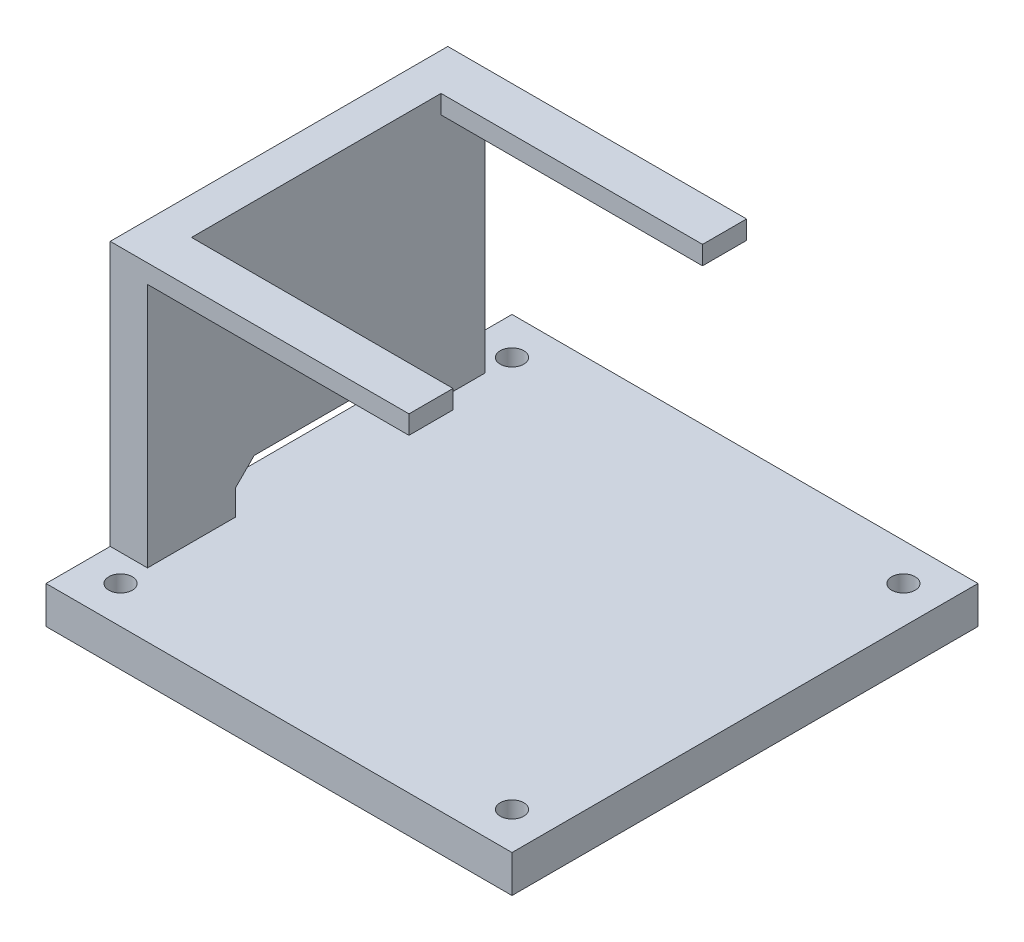
from build123d import *
from build123d.topology import SkipClean

# Parameters (mm, degrees)
SKETCH1_W           = 31.75
SKETCH1_H           = 31.75
BOSS_EXTRUDE1_DEPTH = 2.54
SKETCH3_W           = 2.54
SKETCH3_H           = 3
BOSS_EXTRUDE2_DEPTH = 18
BOSS_EXTRUDE3_DEPTH = 3.000000096
LPATTERN1_COUNT     = 2
LPATTERN1_PITCH     = 19.999999878
SKETCH7_R           = 0.8
CUT_EXTRUDE1_DEPTH  = 29.775532141
SKETCH8_W           = 2.54
SKETCH8_H           = 18
BOSS_EXTRUDE4_DEPTH = 17.000000036
SKETCH10_W          = 11
SKETCH10_H          = 3
CUT_EXTRUDE2_DEPTH  = 2.54
CHAMFER1_SIZE       = 1.27


with BuildPart() as part:
    # Sketch1 → Boss-Extrude1 (new body)
    with BuildSketch(Plane(origin=(0, 0, 0), x_dir=(1, 0, 0), z_dir=(0, 1, 0))):
        Rectangle(SKETCH1_W, SKETCH1_H)
    extrude(amount=BOSS_EXTRUDE1_DEPTH)

    # Sketch3 → Boss-Extrude2 (add)
    with BuildSketch(Plane(origin=(0, 2.54, 0), x_dir=(1, 0, 0), z_dir=(0, 1, 0))):
        with Locations((-14.605, -10.000000018)):
            Rectangle(SKETCH3_W, SKETCH3_H)
        with Locations((-14.605, 10.000000018)):
            Rectangle(SKETCH3_W, SKETCH3_H)
    extrude(amount=BOSS_EXTRUDE2_DEPTH)

    # Sketch6 → Boss-Extrude3 (add)
    with BuildSketch(Plane.XY.offset(11.500000018)):
        Polygon((-13.335, 20.54), (-13.335, 19.27), (4.479844611, 19.27), (4.482298438, 20.54), align=None)
    boss_extrude3 = extrude(amount=-BOSS_EXTRUDE3_DEPTH)

    # LPattern1: Boss-Extrude3 ×2
    with SkipClean():  # the faces are left unmerged after this step: merging them gives an invalid solid
        with Locations(*[(0, 0, -i * LPATTERN1_PITCH) for i in range(1, LPATTERN1_COUNT)]):
            add(boss_extrude3)

    # Sketch7 → Cut-Extrude1 (cut, through all)
    with SkipClean():  # the faces are left unmerged after this step: merging them gives an invalid solid
        with BuildSketch(Plane(origin=(0, 2.54, 0), x_dir=(1, 0, 0), z_dir=(0, 1, 0))):
            with Locations(Location((13.335, 13.335, 0), (0, 0, 270))):
                Circle(SKETCH7_R)
            with Locations(Location((-13.335, 13.335, 0), (0, 0, 270))):
                Circle(SKETCH7_R)
            with Locations(Location((-13.335, -13.335, 0), (0, 0, 270))):
                Circle(SKETCH7_R)
            with Locations(Location((13.335, -13.335, 0), (0, 0, 270))):
                Circle(SKETCH7_R)
        extrude(amount=-CUT_EXTRUDE1_DEPTH, mode=Mode.SUBTRACT)

    # Sketch8 → Boss-Extrude4 (add)
    with BuildSketch(Plane(origin=(0, 0, 8.500000018), x_dir=(-1, 0, 0), z_dir=(0, 0, -1))):
        with Locations((14.605, 11.54)):
            Rectangle(SKETCH8_W, SKETCH8_H)
    extrude(amount=BOSS_EXTRUDE4_DEPTH)

    # Sketch10 → Cut-Extrude2 (cut)
    with BuildSketch(Plane(origin=(-13.335, 0, 0), x_dir=(0, 0, -1), z_dir=(1, 0, 0))):
        with Locations((0, 4.04)):
            Rectangle(SKETCH10_W, SKETCH10_H)
    extrude(amount=-CUT_EXTRUDE2_DEPTH, mode=Mode.SUBTRACT)

    # Chamfer1
    chamfer1_edges = [part.edges().sort_by_distance(p)[0] for p in [
        (-14.605, 5.54, -5.5),
        (-14.605, 5.54, 5.5),
    ]]
    chamfer(chamfer1_edges, length=CHAMFER1_SIZE)


solid = part.part
